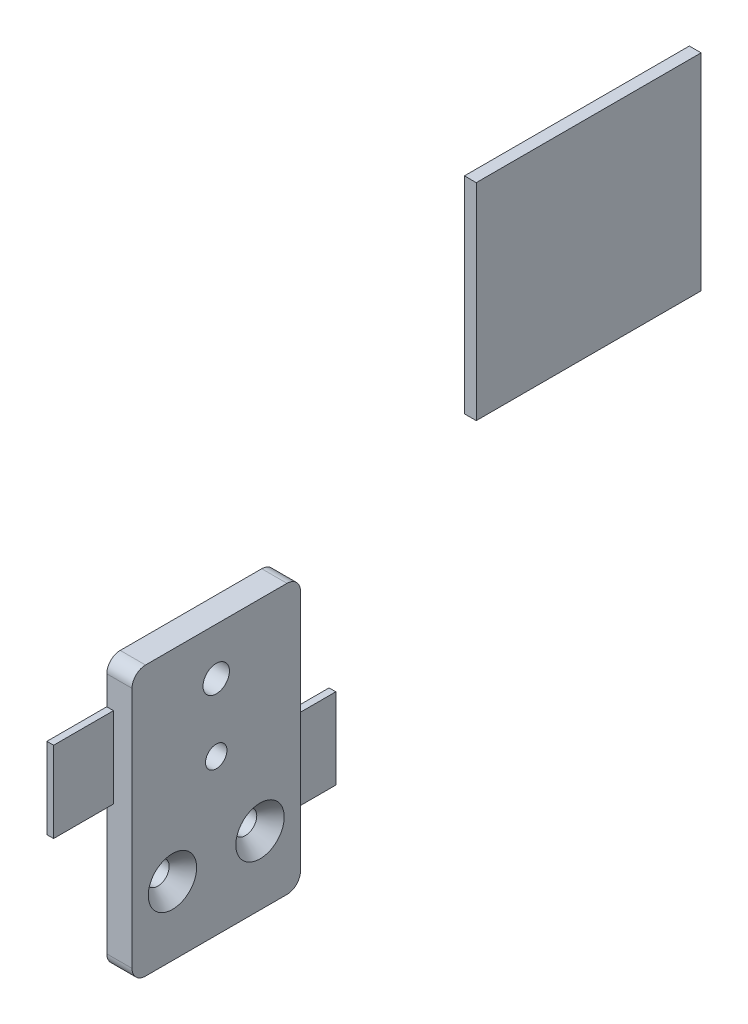
from build123d import *

# Parameters (mm, degrees)
SKETCH1_W                                     = 31.75
SKETCH1_H                                     = 50.8
BOSS_EXTRUDE1_DEPTH                           = 4.7625
CSK_FOR_8_FLAT_HEAD_SOCKET_CAP_SCREW1_A_COUNT = 2
CSK_FOR_8_FLAT_HEAD_SOCKET_CAP_SCREW1_A_PITCH = 16.51
F_10_CLEARANCE_HOLE1_D                        = 4.9784
FILLET1_R                                     = 2.54
F_10_32_TAPPED_HOLE1_D                        = 4.0386
SKETCH10_W                                    = 42.392471332
SKETCH10_H                                    = 38.859765387
BOSS_EXTRUDE2_DEPTH                           = 2.2225
SKETCH11_W                                    = 11.290377963
SKETCH11_H                                    = 15.24
SKETCH11_W_2                                  = 10.158335204
BOSS_EXTRUDE3_DEPTH                           = 1.27


with BuildPart() as part:
    # Sketch1 → Boss-Extrude1 (new body)
    with BuildSketch(Plane(origin=(0, 0, 0), x_dir=(0, 0, -1), z_dir=(1, 0, 0))):
        Rectangle(SKETCH1_W, SKETCH1_H)
    extrude(amount=BOSS_EXTRUDE1_DEPTH)

    # Sketch5 → CSK for #8 Flat Head Socket Cap Screw1 (revolve, cut)
    with BuildSketch(Plane(origin=(4.7625, -12.4841, 8.255), x_dir=(0, 0, -1), z_dir=(0, 1, 0))):
        Polygon((0, 0), (0, 4.7625), (2.15265, 4.7625), (2.15265, 2.768534127), (4.5593, 0), align=None)
    csk_for_8_flat_head_socket_cap_screw1 = revolve(axis=Axis((11.1125, -12.4841, 8.255), (-1, 0, 0)), mode=Mode.SUBTRACT)

    # CSK for #8 Flat Head Socket Cap Screw1 a: CSK for #8 Flat Head Socket Cap Screw1 ×2
    with Locations(*[(0, 0, -i * CSK_FOR_8_FLAT_HEAD_SOCKET_CAP_SCREW1_A_PITCH) for i in range(1, CSK_FOR_8_FLAT_HEAD_SOCKET_CAP_SCREW1_A_COUNT)]):
        add(csk_for_8_flat_head_socket_cap_screw1, mode=Mode.SUBTRACT)

    # #10 Clearance Hole1 (through all)
    with Locations(Plane(origin=(4.7625, 0, 0), x_dir=(0, 0, -1), z_dir=(1, 0, 0))):
        with Locations((0, 16.51)):
            Hole(F_10_CLEARANCE_HOLE1_D / 2)

    # Fillet1
    fillet1_edges = [part.edges().sort_by_distance(p)[0] for p in [
        (2.38125, -25.4, -15.875),
        (2.38125, -25.4, 15.875),
        (2.38125, 25.4, 15.875),
        (2.38125, 25.4, -15.875),
    ]]
    fillet(fillet1_edges, radius=FILLET1_R)

    # #10-32 Tapped Hole1 (through all)
    with Locations(Plane(origin=(4.7625, 0, 0), x_dir=(0, 0, -1), z_dir=(1, 0, 0))):
        with Locations((0, 3.81)):
            Hole(F_10_32_TAPPED_HOLE1_D / 2)

    # Sketch11 → Boss-Extrude3 (add)
    with BuildSketch(Plane.ZY):
        with Locations((21.520188982, 9.851988794)):
            Rectangle(SKETCH11_W, SKETCH11_H)
        with Locations((-20.954167602, -8.02048127)):
            Rectangle(SKETCH11_W_2, SKETCH11_H)
    extrude(amount=-BOSS_EXTRUDE3_DEPTH)


with BuildPart() as body_2:
    # Sketch10 → Boss-Extrude2 (new body)
    with BuildSketch(Plane(origin=(4.7625, 0, 0), x_dir=(0, 0, -1), z_dir=(1, 0, 0))):
        with Locations((70.212530643, 53.542574468)):
            Rectangle(SKETCH10_W, SKETCH10_H)
    extrude(amount=-BOSS_EXTRUDE2_DEPTH)


solid = Compound([part.part, body_2.part])
